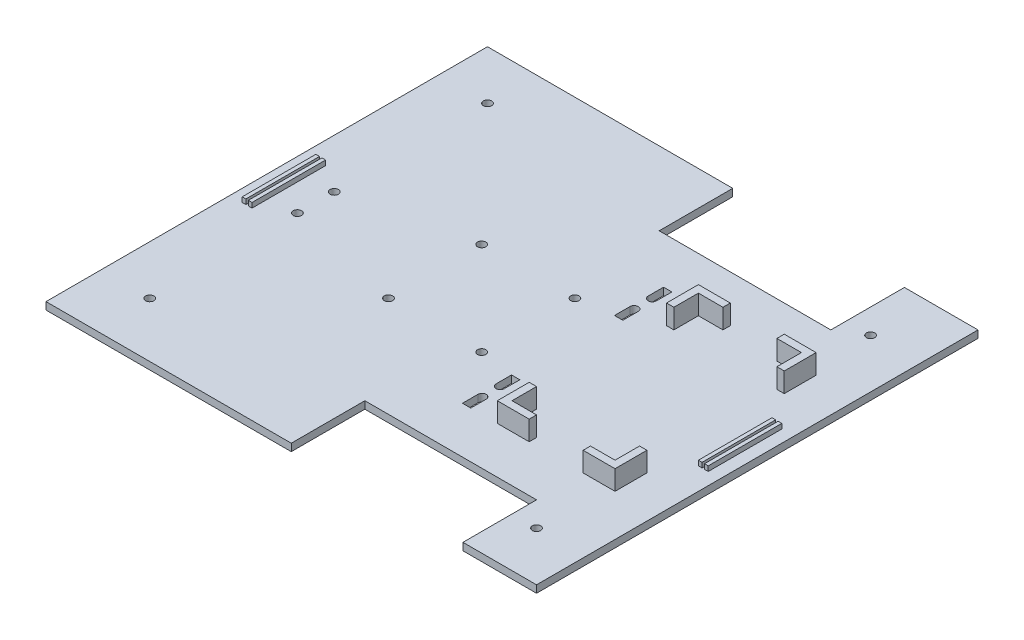
from build123d import *

# Parameters (mm, degrees)
SKETCH1_R           = 43.18
BOSS_EXTRUDE1_DEPTH = 76.2
BOSS_EXTRUDE4_DEPTH = 203.2
BOSS_EXTRUDE8_DEPTH = 50.8


with BuildPart() as part:
    # Sketch1 → Boss-Extrude1 (new body)
    with BuildSketch(Plane(origin=(0, 0, 0), x_dir=(1, 0, 0), z_dir=(0, 1, 0))):
        Polygon((-48.943073508, 29.635887653), (1729.056926492, 29.635887653), (1729.056926492, -732.364112347), (2491.056926492, -732.364112347), (2491.056926492, 3839.635887653), (1729.056926492, 3839.635887653), (1729.056926492, 3077.635887653), (-48.943073508, 3077.635887653), (-48.943073508, 3839.635887653), (-2588.943073508, 3839.635887653), (-2588.943073508, -732.364112347), (-48.943073508, -732.364112347), align=None)
        with Locations(Location((-2080.943073508, -166.508163088, 0), (0, 0, 90))):
            Circle(SKETCH1_R, mode=Mode.SUBTRACT)
        with Locations(Location((-2080.943073508, 1744.135887653, 0), (0, 0, 90))):
            Circle(SKETCH1_R, mode=Mode.SUBTRACT)
        with Locations(Location((-2080.943073508, 1363.135887653, 0), (0, 0, 90))):
            Circle(SKETCH1_R, mode=Mode.SUBTRACT)
        with Locations(Location((-2080.943073508, 3331.635887653, 0), (0, 0, 90))):
            Circle(SKETCH1_R, mode=Mode.SUBTRACT)
        with Locations(Location((1983.056926492, -224.364112347, 0), (0, 0, 90))):
            Circle(SKETCH1_R, mode=Mode.SUBTRACT)
        with Locations(Location((1983.056926492, 3235.099053778, 0), (0, 0, 90))):
            Circle(SKETCH1_R, mode=Mode.SUBTRACT)
        with Locations(Location((-845.456188569, 1071.035887653, 0), (0, 0, 90))):
            Circle(SKETCH1_R, mode=Mode.SUBTRACT)
        with Locations(Location((119.743811431, 1071.035887653, 0), (0, 0, 90))):
            Circle(SKETCH1_R, mode=Mode.SUBTRACT)
        with Locations(Location((119.743811431, 2036.235887653, 0), (0, 0, 90))):
            Circle(SKETCH1_R, mode=Mode.SUBTRACT)
        with Locations(Location((-845.456188569, 2036.235887653, 0), (0, 0, 90))):
            Circle(SKETCH1_R, mode=Mode.SUBTRACT)
        with BuildLine():
            Line((565.736926492, 2435.015887653), (565.736926492, 2595.035887653))
            Line((565.736926492, 2595.035887653), (479.376926492, 2595.035887653))
            Line((479.376926492, 2595.035887653), (479.376926492, 2435.015887653))
            ThreePointArc((479.376926492, 2435.015887653), (522.556926492, 2391.835887653), (565.736926492, 2435.015887653))
        make_face(mode=Mode.SUBTRACT)
        with BuildLine():
            Line((565.736926492, 2247.055887653), (565.736926492, 2087.035887653))
            Line((565.736926492, 2087.035887653), (479.376926492, 2087.035887653))
            Line((479.376926492, 2087.035887653), (479.376926492, 2247.055887653))
            ThreePointArc((479.376926492, 2247.055887653), (522.556926492, 2290.235887653), (565.736926492, 2247.055887653))
        make_face(mode=Mode.SUBTRACT)
        with BuildLine():
            Line((479.376926492, 1020.235887653), (479.376926492, 860.215887653))
            ThreePointArc((479.376926492, 860.215887653), (522.556926492, 817.035887653), (565.736926492, 860.215887653))
            Line((565.736926492, 860.215887653), (565.736926492, 1020.235887653))
            Line((565.736926492, 1020.235887653), (479.376926492, 1020.235887653))
        make_face(mode=Mode.SUBTRACT)
        with BuildLine():
            Line((479.376926492, 512.235887653), (479.376926492, 672.255887653))
            ThreePointArc((479.376926492, 672.255887653), (522.556926492, 715.435887653), (565.736926492, 672.255887653))
            Line((565.736926492, 672.255887653), (565.736926492, 512.235887653))
            Line((565.736926492, 512.235887653), (479.376926492, 512.235887653))
        make_face(mode=Mode.SUBTRACT)
    extrude(amount=BOSS_EXTRUDE1_DEPTH)

    # Sketch2 → Boss-Extrude4 (add)
    with BuildSketch(Plane(origin=(0, 76.2, 0), x_dir=(1, 0, 0), z_dir=(0, 1, 0))):
        Polygon((2059.256926492, 512.235887653), (2059.256926492, 842.435887653), (1983.056926492, 842.435887653), (1983.056926492, 588.435887653), (1729.056926492, 588.435887653), (1729.056926492, 512.235887653), align=None)
        Polygon((840.056926492, 842.435887653), (916.256926492, 842.435887653), (916.256926492, 588.435887653), (1170.256926492, 588.435887653), (1170.256926492, 512.235887653), (840.056926492, 512.235887653), align=None)
        Polygon((840.056926492, 2595.035887653), (840.056926492, 2264.835887653), (916.256926492, 2264.835887653), (916.256926492, 2518.835887653), (1170.256926492, 2518.835887653), (1170.256926492, 2595.035887653), align=None)
        Polygon((2059.256926492, 2264.835887653), (1983.056926492, 2264.835887653), (1983.056926492, 2518.835887653), (1729.056926492, 2518.835887653), (1729.056926492, 2595.035887653), (2059.256926492, 2595.035887653), align=None)
    extrude(amount=BOSS_EXTRUDE4_DEPTH)

    # Sketch5 → Boss-Extrude8 (add)
    with BuildSketch(Plane(origin=(0, 76.2, 0), x_dir=(1, 0, 0), z_dir=(0, 1, 0))):
        Polygon((2300.556926492, 1172.635887653), (2300.556926492, 1553.635887653), (2300.556926492, 1934.635887653), (2262.456926492, 1934.635887653), (2262.456926492, 1172.635887653), align=None)
        Polygon((-2461.943073508, 1553.635887653), (-2461.943073508, 1934.635887653), (-2423.843073508, 1934.635887653), (-2423.843073508, 1172.635887653), (-2461.943073508, 1172.635887653), align=None)
        Polygon((-2398.443073508, 1553.635887653), (-2398.443073508, 1934.635887653), (-2360.343073508, 1934.635887653), (-2360.343073508, 1172.635887653), (-2398.443073508, 1172.635887653), align=None)
        Polygon((2364.056926492, 1172.635887653), (2364.056926492, 1553.635887653), (2364.056926492, 1934.635887653), (2325.956926492, 1934.635887653), (2325.956926492, 1172.635887653), align=None)
    extrude(amount=BOSS_EXTRUDE8_DEPTH)


solid = part.part
